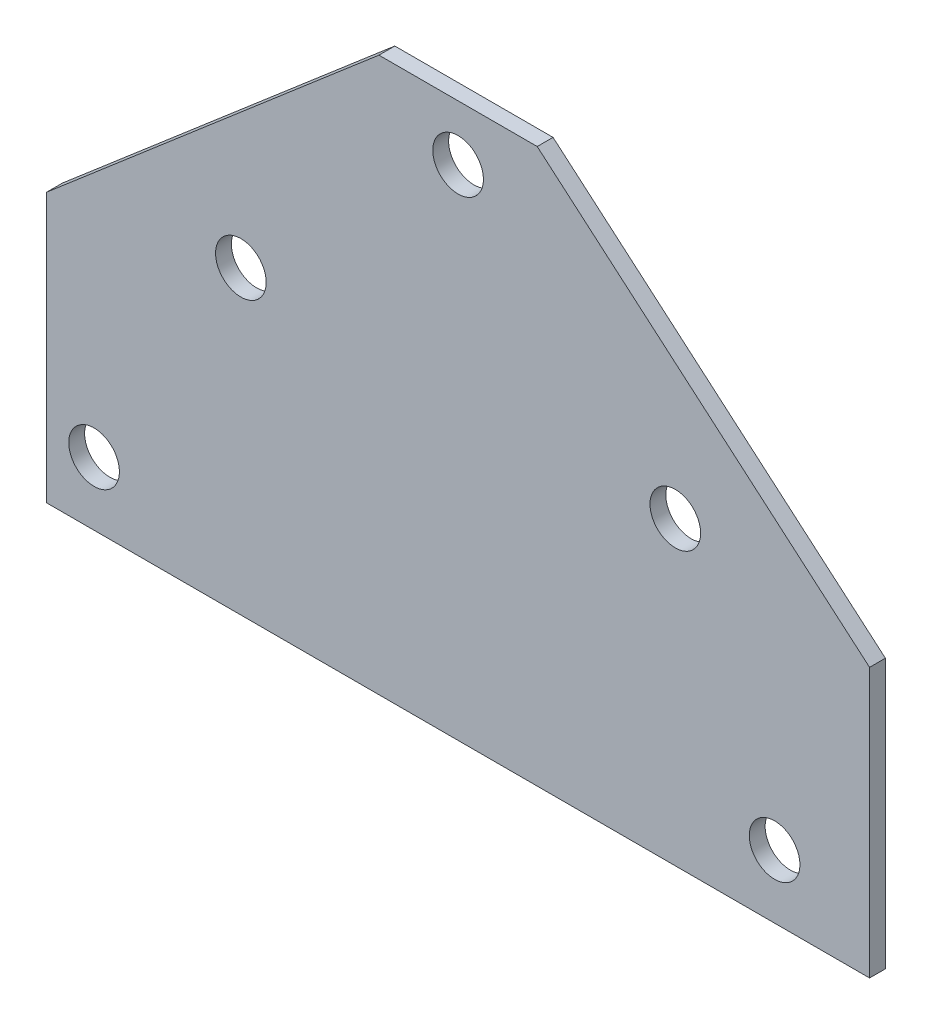
from build123d import *

# Parameters (mm, degrees)
SKETCH_1_R      = 1.6
EXTRUDE_1_DEPTH = 1


with BuildPart() as part:
    # 草图1 → 凸台-拉伸1 (new body)
    with BuildSketch(Plane.XY):
        Polygon((26, 0), (-26, 0), (-26, 17), (-5, 35), (5, 35), (26, 17), align=None)
        with Locations((-13.725, 19)):
            Circle(SKETCH_1_R, mode=Mode.SUBTRACT)
        with Locations(Location((13.725, 19, 0), (0, 0, 180))):
            Circle(SKETCH_1_R, mode=Mode.SUBTRACT)
        with Locations((-23, 4)):
            Circle(SKETCH_1_R, mode=Mode.SUBTRACT)
        with Locations(Location((20, 4, 0), (0, 0, 180))):
            Circle(SKETCH_1_R, mode=Mode.SUBTRACT)
        with Locations((0, 31.5)):
            Circle(SKETCH_1_R, mode=Mode.SUBTRACT)
    extrude(amount=EXTRUDE_1_DEPTH)


solid = part.part
